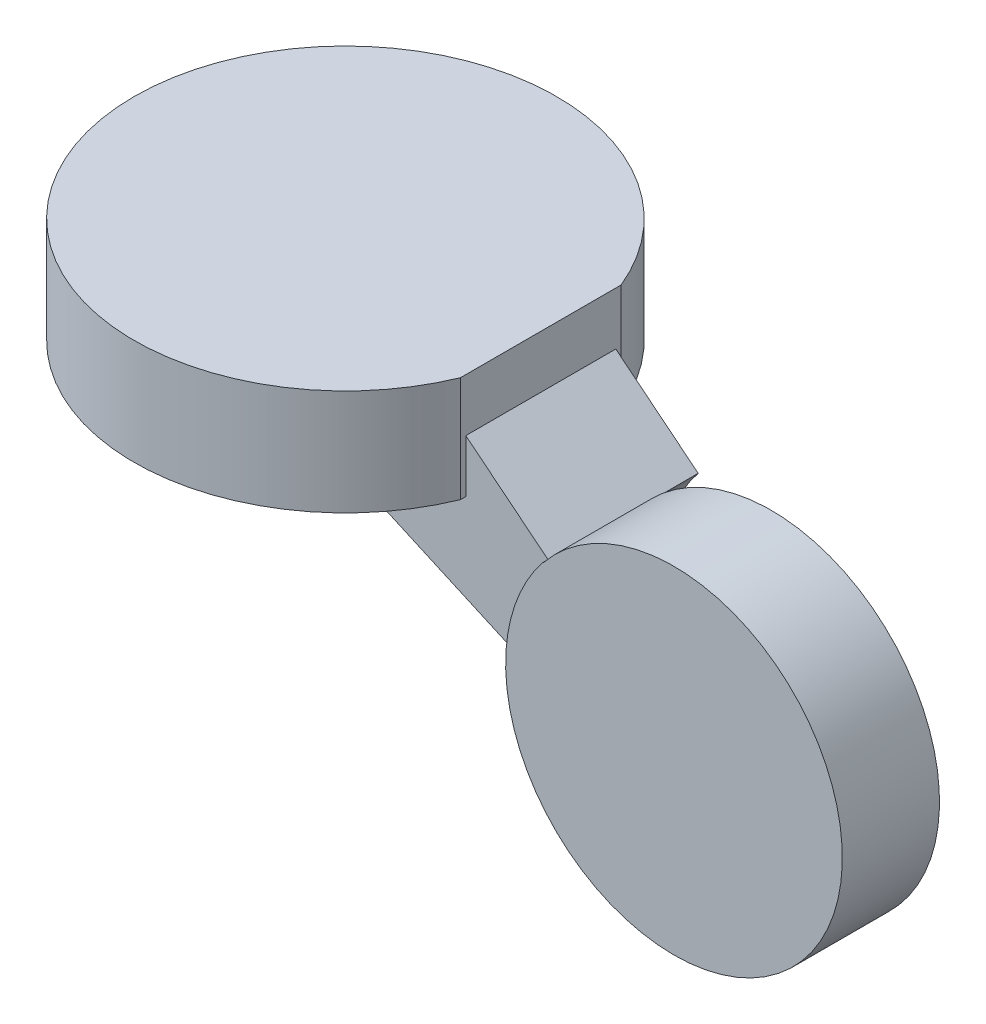
from build123d import *

# Parameters (mm, degrees)
SKETCH1_R           = 200
BOSS_EXTRUDE1_DEPTH = 100
CUT_EXTRUDE2_DEPTH  = 100
BOSS_EXTRUDE2_DEPTH = 75.993421
BOSS_EXTRUDE3_DEPTH = 75.993421
SKETCH9_R           = 159.375
BOSS_EXTRUDE4_DEPTH = 151.986842
CUT_EXTRUDE3_START  = -60
SKETCH11_R          = 159.375
CUT_EXTRUDE3_DEPTH  = 60
CUT_EXTRUDE4_DEPTH  = 5
CUT_EXTRUDE5_DEPTH  = 5


with BuildPart() as part:
    # Sketch1 → Boss-Extrude1 (new body)
    with BuildSketch(Plane(origin=(0, 0, 0), x_dir=(1, 0, 0), z_dir=(0, 1, 0))):
        with Locations(Location((0, 0, 0), (0, 0, 270))):
            Circle(SKETCH1_R)
    extrude(amount=BOSS_EXTRUDE1_DEPTH)

    # Sketch2 → Cut-Extrude2 (cut)
    with BuildSketch(Plane(origin=(0, 100, 0), x_dir=(1, 0, 0), z_dir=(0, 1, 0))):
        Polygon((185, 0), (185, 120.642549135), (200, 120.642549135), (200, 0), (200, -137.849885779), (185, -137.849885779), align=None)
    extrude(amount=-CUT_EXTRUDE2_DEPTH, mode=Mode.SUBTRACT)

    # Sketch4 → Boss-Extrude2 (add)
    with BuildSketch(Plane.XY):
        Polygon((185, 50), (185, 0), (0, 0), (251.924557131, -112.966443103), (387.075695624, -112.966443103), align=None)
    extrude(amount=-BOSS_EXTRUDE2_DEPTH)

    # Sketch7 → Boss-Extrude3 (add)
    with BuildSketch(Plane.XY):
        Polygon((0, 0), (185, 0), (185, 50), (387.075695624, -112.966443103), (251.924557131, -112.966443103), align=None)
    extrude(amount=BOSS_EXTRUDE3_DEPTH)

    # Sketch9 → Boss-Extrude4 (add)
    with BuildSketch(Plane.XY.offset(75.993420768)):
        with Locations((387.075695624, -112.966443103)):
            Circle(SKETCH9_R)
    extrude(amount=-BOSS_EXTRUDE4_DEPTH)

    # Sketch11 → Cut-Extrude3 (cut)
    with BuildSketch(Plane(origin=(0, 0, -75.993420768), x_dir=(-1, 0, 0), z_dir=(0, 0, -1)).offset(CUT_EXTRUDE3_START)):
        with Locations((-387.075695624, -112.966443103)):
            Circle(SKETCH11_R)
    extrude(amount=CUT_EXTRUDE3_DEPTH, mode=Mode.SUBTRACT)


with BuildPart() as cut_extrude3_kept_piece:
    # of the separate pieces the step leaves, the one the design keeps (cut_extrude3_pieces_kept)
    add(part.part.solids().sort_by_distance((185, 0, -75.993420884))[0])

    # Sketch12 → Cut-Extrude4 (cut)
    with BuildSketch(Plane.XY.offset(75.993420768)):
        with BuildLine():
            Line((185, 0), (0, 0))
            Line((0, 0), (228.060355378, -102.265406172))
            ThreePointArc((228.060355378, -102.265406172), (238.589276077, -54.846272892), (262.770904395, -12.719307371))
            Line((262.770904395, -12.719307371), (185, 50))
            Line((185, 50), (185, 0))
        make_face()
    extrude(amount=-CUT_EXTRUDE4_DEPTH, mode=Mode.SUBTRACT)

    # Sketch14 → Cut-Extrude5 (cut)
    with BuildSketch(Plane(origin=(0, 0, -75.993420768), x_dir=(-1, 0, 0), z_dir=(0, 0, -1))):
        with BuildLine():
            Line((-228.060355378, -102.265406172), (0, 0))
            Line((0, 0), (-185, 0))
            Line((-185, 0), (-185, 50))
            Line((-185, 50), (-263.016769179, -12.917588066))
            ThreePointArc((-263.016769179, -12.917588066), (-238.655621962, -54.898617596), (-228.060355378, -102.265406172))
        make_face()
    extrude(amount=-CUT_EXTRUDE5_DEPTH, mode=Mode.SUBTRACT)


solid = cut_extrude3_kept_piece.part
